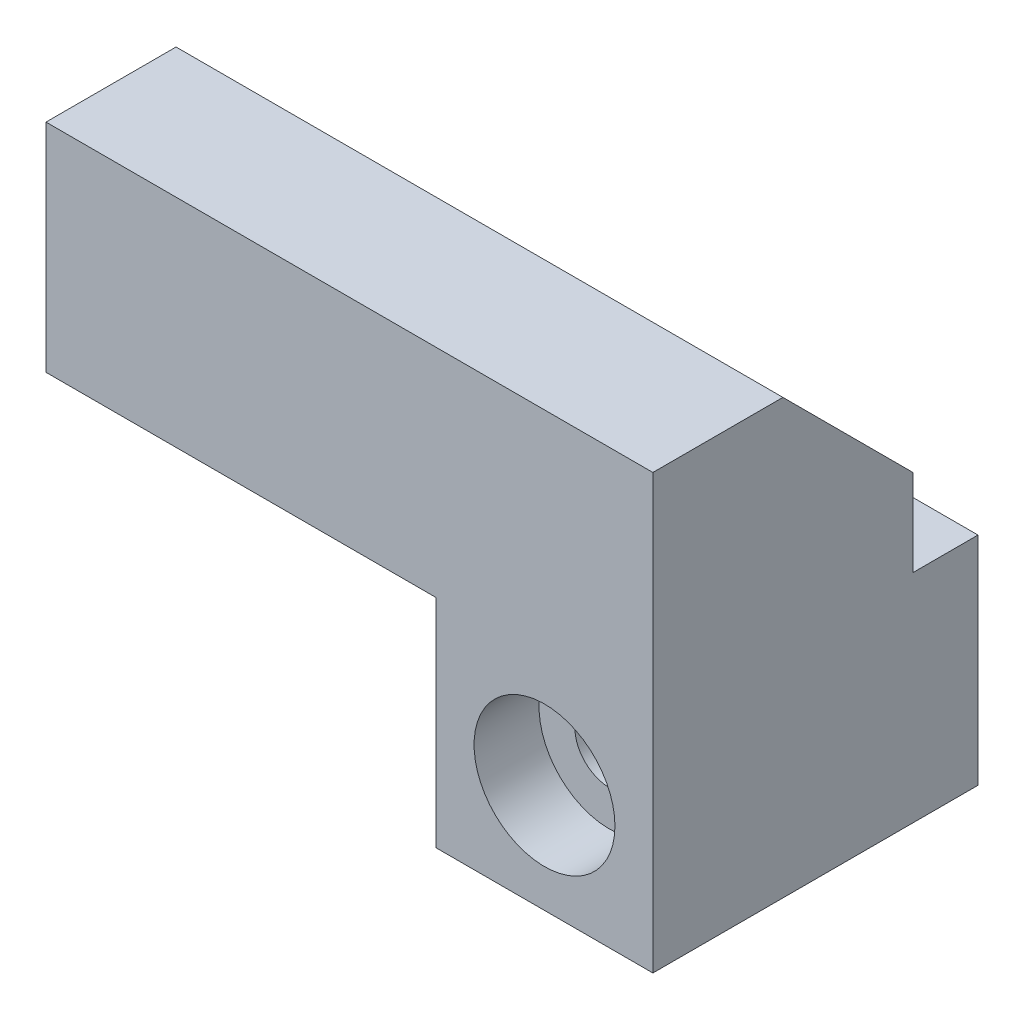
from build123d import *

# Parameters (mm, degrees)
BOSS_EXTRUDE1_DEPTH                                 = 5
SKETCH4_W                                           = 10
SKETCH4_H                                           = 12
BOSS_EXTRUDE2_DEPTH                                 = 10
CBORE_FOR_M3_HEX_SOCKET_HEAD_CAP_SCREW1_D           = 3.2
CBORE_FOR_M3_HEX_SOCKET_HEAD_CAP_SCREW1_CBORE_D     = 6.5
CBORE_FOR_M3_HEX_SOCKET_HEAD_CAP_SCREW1_CBORE_DEPTH = 3
CHAMFER1_SIZE                                       = 6
BOSS_EXTRUDE3_START                                 = 3
SKETCH5_W                                           = 10
SKETCH5_H                                           = 10
SKETCH5_R                                           = 1.6
BOSS_EXTRUDE3_DEPTH                                 = 3
CUT_EXTRUDE1_DEPTH                                  = 4


with BuildPart() as part:
    # Sketch1 → Boss-Extrude1 (new, symmetric)
    with BuildSketch(Plane(origin=(0, 0, 0), x_dir=(1, 0, 0), z_dir=(0, 1, 0))):
        Polygon((0, 0), (-28, 0), (-28, 6), (-10, 6), (-10, 12), (0, 12), align=None)
    extrude(amount=BOSS_EXTRUDE1_DEPTH, both=True)

    # Sketch4 → Boss-Extrude2 (add)
    with BuildSketch(Plane.XZ.offset(5)):
        with Locations((-5, -6)):
            Rectangle(SKETCH4_W, SKETCH4_H)
    extrude(amount=BOSS_EXTRUDE2_DEPTH)

    # CBORE for M3 Hex Socket Head Cap Screw1 (through all)
    with Locations(Plane.XY):
        with Locations((-5, -10)):
            CounterBoreHole(CBORE_FOR_M3_HEX_SOCKET_HEAD_CAP_SCREW1_D / 2, CBORE_FOR_M3_HEX_SOCKET_HEAD_CAP_SCREW1_CBORE_D / 2, CBORE_FOR_M3_HEX_SOCKET_HEAD_CAP_SCREW1_CBORE_DEPTH)

    # Chamfer1
    chamfer1_edges = [part.edges().sort_by_distance(p)[0] for p in [
        (-5, 5, -12),
    ]]
    chamfer(chamfer1_edges, length=CHAMFER1_SIZE)

    # Sketch5 → Boss-Extrude3 (add)
    with BuildSketch(Plane(origin=(0, 0, -12), x_dir=(-1, 0, 0), z_dir=(0, 0, -1)).offset(BOSS_EXTRUDE3_START)):
        with Locations((5, -10)):
            Rectangle(SKETCH5_W, SKETCH5_H)
        with Locations(Location((5, -10, 0), (0, 0, 180))):
            Circle(SKETCH5_R, mode=Mode.SUBTRACT)
    extrude(amount=-BOSS_EXTRUDE3_DEPTH)

    # Sketch6 → Cut-Extrude1 (cut)
    with BuildSketch(Plane(origin=(0, 0, -15), x_dir=(-1, 0, 0), z_dir=(0, 0, -1))):
        Polygon((5, -13.233161507), (7.8, -11.616580754), (7.8, -8.383419246), (5, -6.766838493), (2.2, -8.383419246), (2.2, -11.616580754), align=None)
    extrude(amount=-CUT_EXTRUDE1_DEPTH, mode=Mode.SUBTRACT)


solid = part.part
